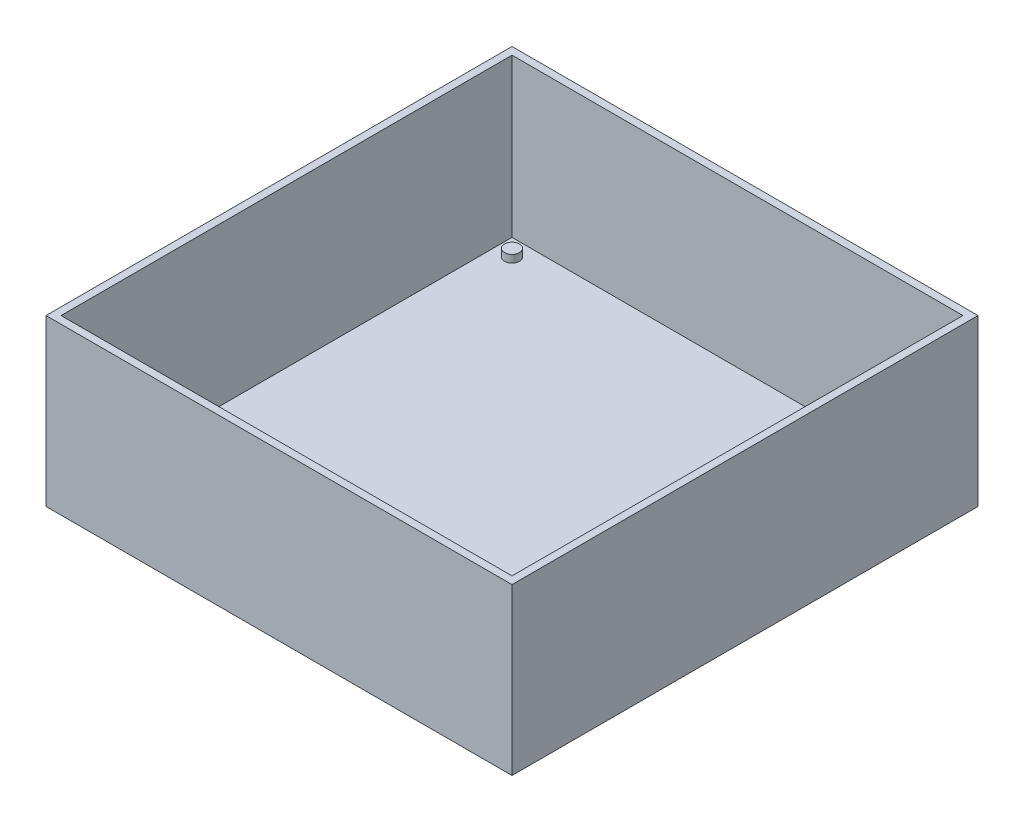
from build123d import *

# Parameters (mm, degrees)
SKETCH_2_W      = 124
SKETCH_2_H      = 124
EXTRUDE_1_DEPTH = 2
SKETCH_6_W      = 124
SKETCH_6_H      = 124
SKETCH_6_W_2    = 120
SKETCH_6_H_2    = 120
EXTRUDE_3_DEPTH = 42
SKETCH_7_R      = 2
EXTRUDE_4_DEPTH = 2


with BuildPart() as part:
    # 草图2 → 凸台-拉伸1 (new body)
    with BuildSketch(Plane(origin=(0, 0, 0), x_dir=(1, 0, 0), z_dir=(0, 1, 0))):
        with Locations((62, 62)):
            Rectangle(SKETCH_2_W, SKETCH_2_H)
    extrude(amount=EXTRUDE_1_DEPTH)

    # 草图6 → 凸台-拉伸3 (add)
    with BuildSketch(Plane(origin=(0, 2, 0), x_dir=(1, 0, 0), z_dir=(0, 1, 0))):
        with Locations((62, 62)):
            Rectangle(SKETCH_6_W, SKETCH_6_H)
        with Locations((62, 62)):
            Rectangle(SKETCH_6_W_2, SKETCH_6_H_2, mode=Mode.SUBTRACT)
    extrude(amount=EXTRUDE_3_DEPTH)

    # 草图7 → 凸台-拉伸4 (add)
    with BuildSketch(Plane(origin=(0, 2, 0), x_dir=(1, 0, 0), z_dir=(0, 1, 0))):
        with Locations(Location((6.5, 6.5, 0), (0, 0, 90))):
            Circle(SKETCH_7_R)
        with Locations(Location((117.5, 6.5, 0), (0, 0, 90))):
            Circle(SKETCH_7_R)
        with Locations(Location((6.5, 117.5, 0), (0, 0, 90))):
            Circle(SKETCH_7_R)
        with Locations(Location((117.5, 117.5, 0), (0, 0, 90))):
            Circle(SKETCH_7_R)
    extrude(amount=EXTRUDE_4_DEPTH)


solid = part.part
